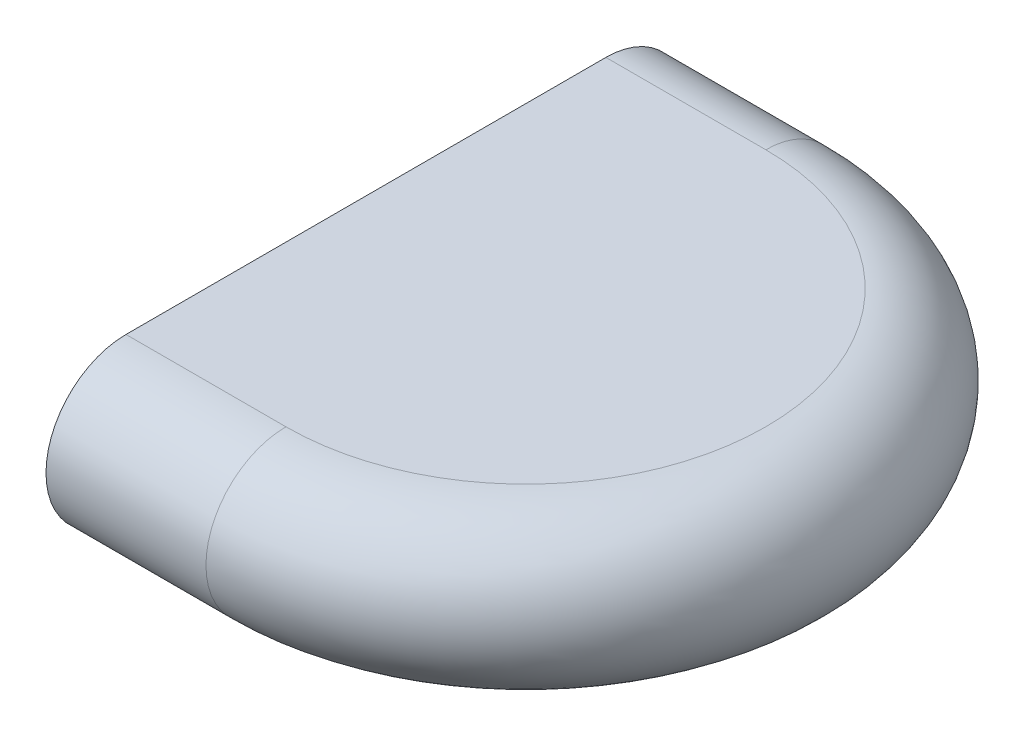
from build123d import *

# Parameters (mm, degrees)
RIVOLUZIONE1_ANGLE           = 180
ESTRUSIONE_ESTRUSIONE1_DEPTH = 2


with BuildPart() as part:
    # Schizzo2 → Rivoluzione1 (revolve)
    with BuildSketch(Plane(origin=(0, 0, 0), x_dir=(0, 0, -1), z_dir=(1, 0, 0))):
        with BuildLine():
            Line((3, 0), (6, 0))
            ThreePointArc((6, 0), (7, 1), (6, 2))
            Line((6, 2), (3, 2))
            Line((3, 2), (3, 0))
        make_face()
    revolve(axis=Axis((0, 3.541842483, -3), (0, -1, 0)), revolution_arc=RIVOLUZIONE1_ANGLE)

    # Schizzo4 → Estrusione-Estrusione1 (add)
    with BuildSketch(Plane.ZY):
        with BuildLine():
            Line((0, 2), (-6, 2))
            ThreePointArc((-6, 2), (-7, 1), (-6, 0))
            Line((-6, 0), (0, 0))
            ThreePointArc((0, 0), (1, 1), (0, 2))
        make_face()
    extrude(amount=ESTRUSIONE_ESTRUSIONE1_DEPTH)


solid = part.part
